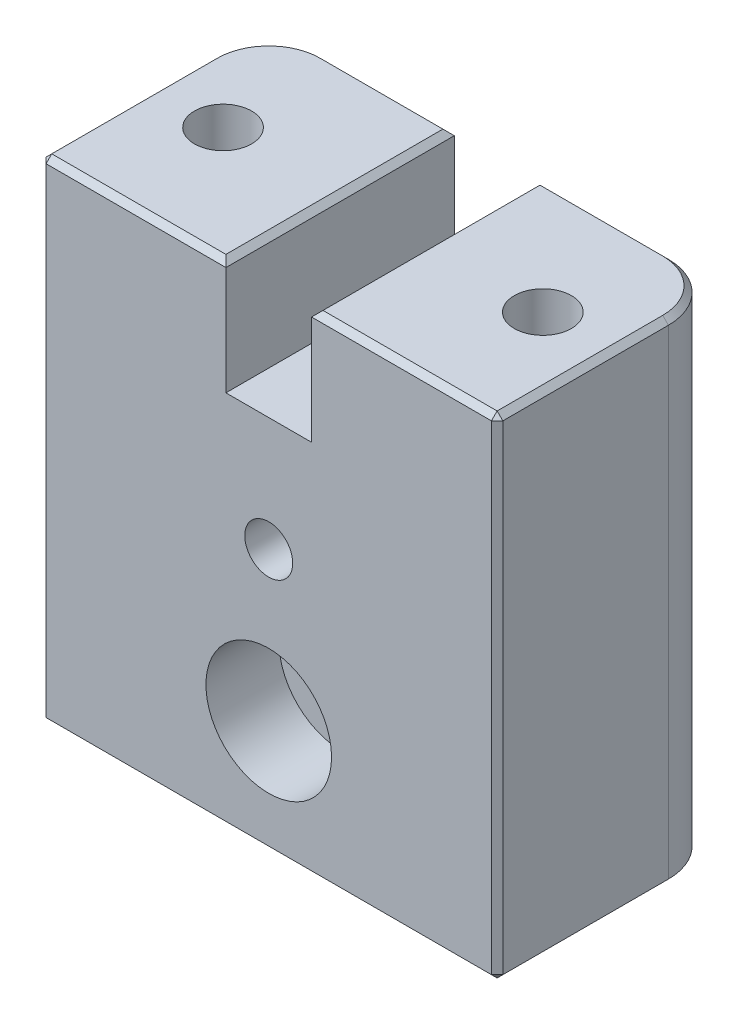
from build123d import *

# Parameters (mm, degrees)
SKETCH1_W                                           = 40
SKETCH1_H                                           = 43
BOSS_EXTRUDE1_DEPTH                                 = 20
SKETCH2_W                                           = 7.5
SKETCH2_H                                           = 20
CUT_EXTRUDE1_DEPTH                                  = 10
M6_TAPPED_HOLE1_D                                   = 5
M6_TAPPED_HOLE1_DEPTH                               = 15
M6_TAPPED_HOLE1_TIP                                 = 1.502151548
FILLET1_R                                           = 5
CHAMFER1_SIZE                                       = 0.5
CBORE_FOR_M6_HEX_SOCKET_HEAD_CAP_SCREW1_D           = 6.4
CBORE_FOR_M6_HEX_SOCKET_HEAD_CAP_SCREW1_CBORE_D     = 11
CBORE_FOR_M6_HEX_SOCKET_HEAD_CAP_SCREW1_CBORE_DEPTH = 6.4
M5_TAPPED_HOLE1_D                                   = 4.2
M5_TAPPED_HOLE1_DEPTH                               = 12.4
M5_TAPPED_HOLE1_TIP                                 = 1.2618073


with BuildPart() as part:
    # Sketch1 → Boss-Extrude1 (new body)
    with BuildSketch(Plane.XY):
        Rectangle(SKETCH1_W, SKETCH1_H)
    extrude(amount=BOSS_EXTRUDE1_DEPTH)

    # Sketch2 → Cut-Extrude1 (cut)
    with BuildSketch(Plane(origin=(0, 21.5, 0), x_dir=(1, 0, 0), z_dir=(0, 1, 0))):
        with Locations((0, -10)):
            Rectangle(SKETCH2_W, SKETCH2_H)
    extrude(amount=-CUT_EXTRUDE1_DEPTH, mode=Mode.SUBTRACT)

    # M6 Tapped Hole1
    with Locations(Plane(origin=(0, 21.5, 0), x_dir=(1, 0, 0), z_dir=(0, 1, 0))):
        with Locations((-14, -10), (14, -10)):
            Hole(M6_TAPPED_HOLE1_D / 2, depth=M6_TAPPED_HOLE1_DEPTH)
            with Locations((0, 0, -(M6_TAPPED_HOLE1_DEPTH + M6_TAPPED_HOLE1_TIP / 2))):  # 118° drill point
                Cone(0, M6_TAPPED_HOLE1_D / 2, M6_TAPPED_HOLE1_TIP, mode=Mode.SUBTRACT)

    # Fillet1
    fillet1_edges = [part.edges().sort_by_distance(p)[0] for p in [
        (-20, 0, 0),
        (20, 0, 0),
    ]]
    fillet(fillet1_edges, radius=FILLET1_R)

    # Chamfer1
    chamfer1_edges = [part.edges().sort_by_distance(p)[0] for p in [
        (-20, 0, 20),
        (-9.375, 21.5, 0),
        (0, -21.5, 20),
        (-11.875, 21.5, 20),
        (-3.75, 21.5, 10),
        (3.75, 21.5, 10),
        (0, -21.5, 0),
        (18.535533906, -21.5, 1.464466094),
        (-18.535533906, -21.5, 1.464466094),
        (9.375, 21.5, 0),
        (-18.535533906, 21.5, 1.464466094),
        (20, 0, 20),
        (18.535533906, 21.5, 1.464466094),
        (20, -21.5, 12.5),
        (-20, -21.5, 12.5),
        (-20, 21.5, 12.5),
        (20, 21.5, 12.5),
        (11.875, 21.5, 20),
    ]]
    chamfer(chamfer1_edges, length=CHAMFER1_SIZE)

    # CBORE for M6 Hex Socket Head Cap Screw1 (through all)
    with Locations(Plane.XY.offset(20)):
        with Locations((0, -11.5)):
            CounterBoreHole(CBORE_FOR_M6_HEX_SOCKET_HEAD_CAP_SCREW1_D / 2, CBORE_FOR_M6_HEX_SOCKET_HEAD_CAP_SCREW1_CBORE_D / 2, CBORE_FOR_M6_HEX_SOCKET_HEAD_CAP_SCREW1_CBORE_DEPTH)

    # M5 Tapped Hole1
    with Locations(Plane.XY.offset(20)):
        with Locations((0, 1.5)):
            Hole(M5_TAPPED_HOLE1_D / 2, depth=M5_TAPPED_HOLE1_DEPTH)
            with Locations((0, 0, -(M5_TAPPED_HOLE1_DEPTH + M5_TAPPED_HOLE1_TIP / 2))):  # 118° drill point
                Cone(0, M5_TAPPED_HOLE1_D / 2, M5_TAPPED_HOLE1_TIP, mode=Mode.SUBTRACT)


solid = part.part
